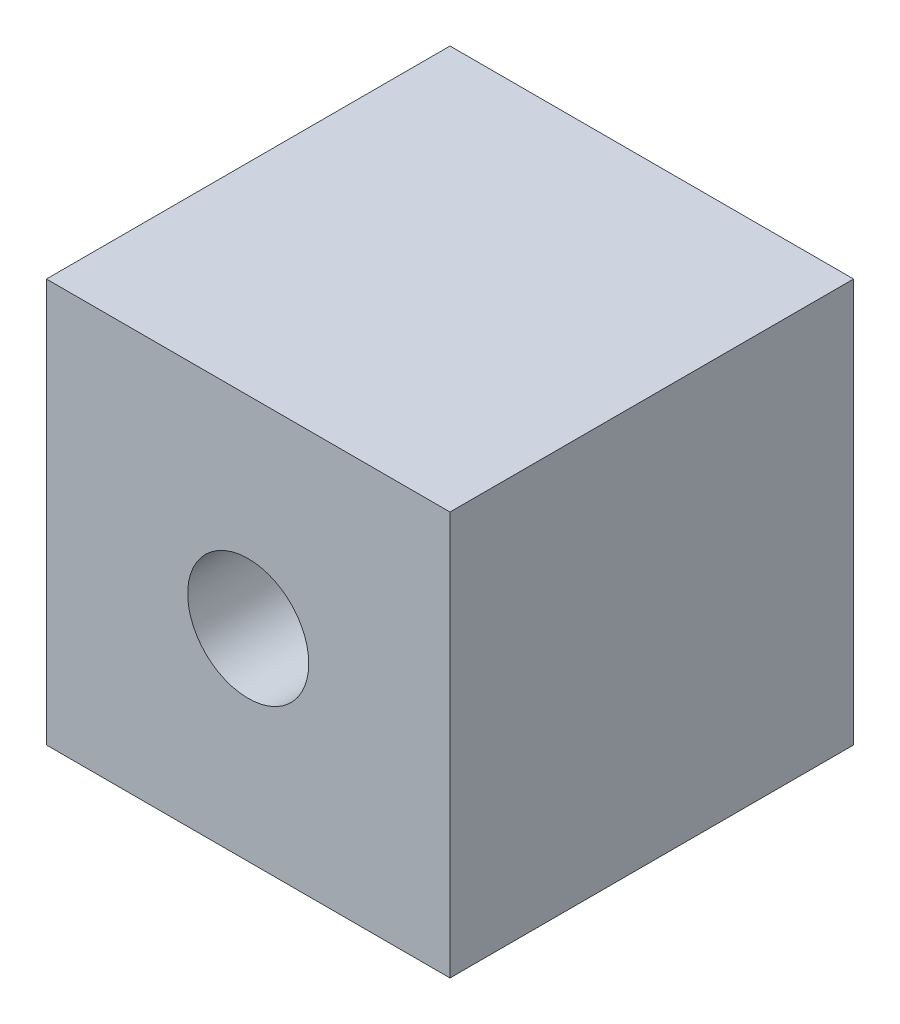
from build123d import *

# Parameters (mm, degrees)
SKETCH1_W           = 10
SKETCH1_H           = 10
BOSS_EXTRUDE1_DEPTH = 10
SKETCH2_R           = 1.5
CUT_EXTRUDE1_DEPTH  = 18.320508076


with BuildPart() as part:
    # Sketch1 → Boss-Extrude1 (new body)
    with BuildSketch(Plane.XY):
        with Locations((5, 5)):
            Rectangle(SKETCH1_W, SKETCH1_H)
    extrude(amount=BOSS_EXTRUDE1_DEPTH)

    # Sketch2 → Cut-Extrude1 (cut, through all)
    with BuildSketch(Plane.XY.offset(10)):
        with Locations((5, 5)):
            Circle(SKETCH2_R)
    extrude(amount=-CUT_EXTRUDE1_DEPTH, mode=Mode.SUBTRACT)


solid = part.part
